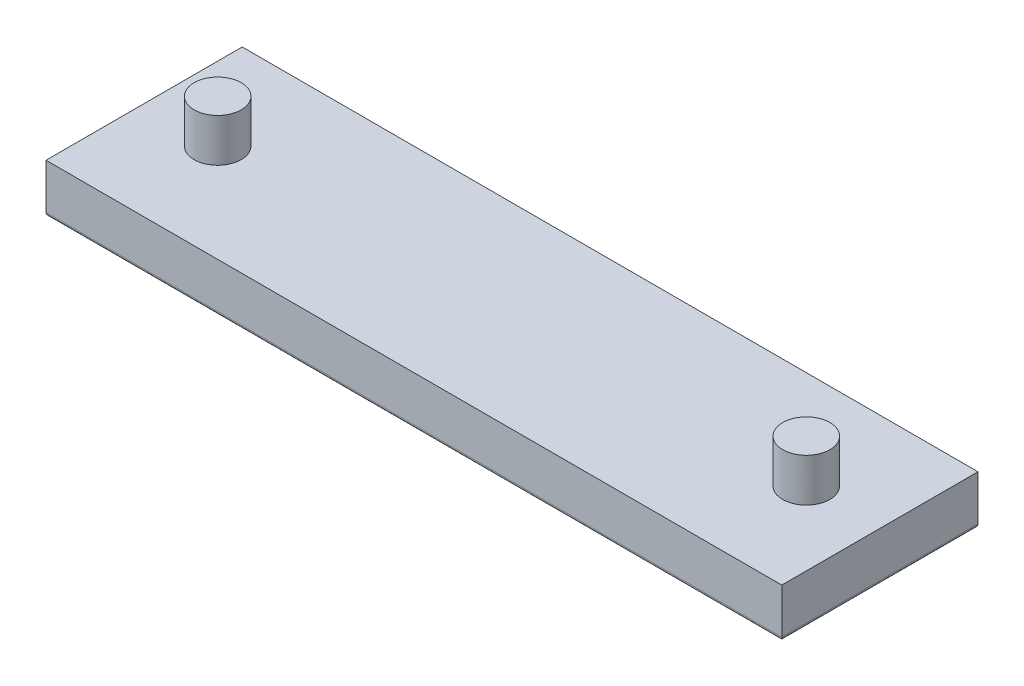
from build123d import *

# Parameters (mm, degrees)
SKETCH1_W           = 95.25
SKETCH1_H           = 25.4
BOSS_EXTRUDE1_DEPTH = 6.35
SKETCH2_R           = 3.048
BOSS_EXTRUDE2_DEPTH = 5.588
FILLET1_R           = 0.508


with BuildPart() as part:
    # Sketch1 → Boss-Extrude1 (new body)
    with BuildSketch(Plane(origin=(0, 0, 0), x_dir=(1, 0, 0), z_dir=(0, 1, 0))):
        Rectangle(SKETCH1_W, SKETCH1_H)
    extrude(amount=BOSS_EXTRUDE1_DEPTH)

    # Sketch2 → Boss-Extrude2 (add)
    with BuildSketch(Plane(origin=(0, 6.35, 0), x_dir=(1, 0, 0), z_dir=(0, 1, 0))):
        with Locations(Location((38.1, 0, 0), (0, 0, 90))):
            Circle(SKETCH2_R)
        with Locations(Location((-38.1, 0, 0), (0, 0, 90))):
            Circle(SKETCH2_R)
    extrude(amount=BOSS_EXTRUDE2_DEPTH)

    # Fillet1
    fillet1_edges = [part.edges().sort_by_distance(p)[0] for p in [
        (0, 0, 12.7),
        (-47.625, 0, 0),
        (0, 0, -12.7),
        (47.625, 0, 0),
    ]]
    fillet(fillet1_edges, radius=FILLET1_R)


solid = part.part
